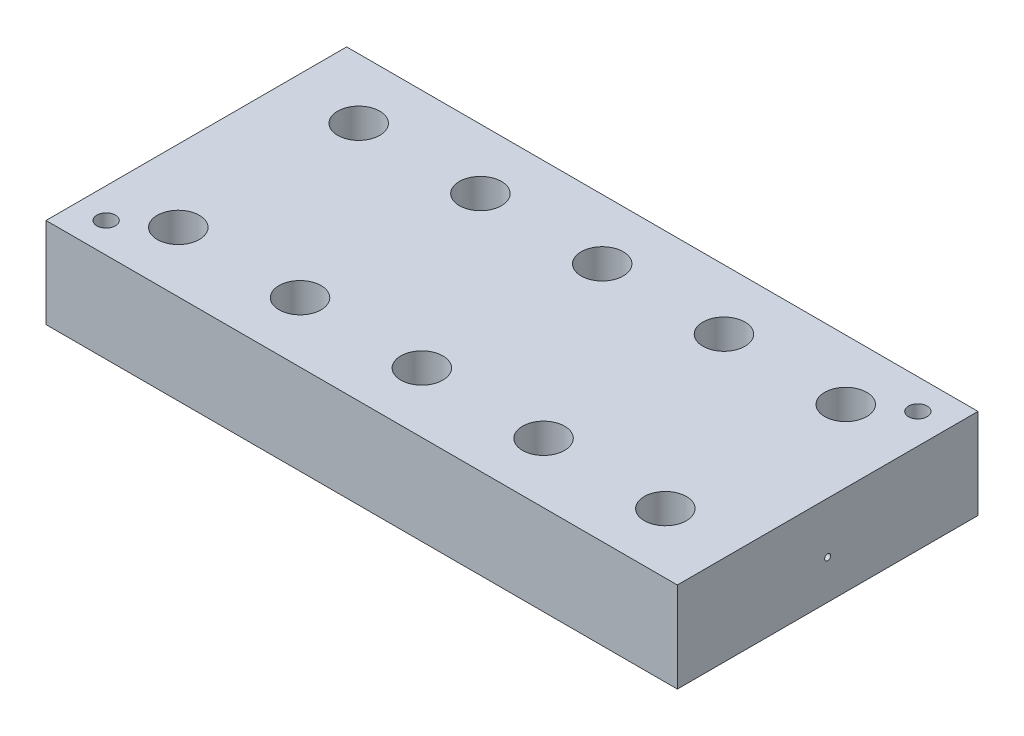
from build123d import *

# Parameters (mm, degrees)
SKETCH2_W                                            = 105
SKETCH2_H                                            = 50
BOSS_EXTRUDE1_DEPTH                                  = 15
SKIZZE7_R                                            = 2.1
SCHNITT_LINEAR_AUSTRAGEN6_DEPTH                      = 10
SKIZZE10_W                                           = 12.5
SKIZZE10_H                                           = 4
ROTATION3_ANGLE                                      = 180
SKIZZE11_W                                           = 12.5
SKIZZE11_H                                           = 4
ROTATION4_ANGLE                                      = 180
CUT_EXTRUDE2_REACH                                   = 113.55
SKETCH5_R                                            = 0.5
SKIZZE14_R                                           = 5.5
SKIZZE15_R                                           = 4
VERRUNDUNG1_R                                        = 1
AUSRICHTUNGSSTIFTE_REACH                             = 71.241
SKIZZE20_R                                           = 1.55
STIRNSENKUNG_F_R_M3_FLACHKOPFSCHRAUBE_MI_D           = 3.4
STIRNSENKUNG_F_R_M3_FLACHKOPFSCHRAUBE_MI_CBORE_D     = 7
STIRNSENKUNG_F_R_M3_FLACHKOPFSCHRAUBE_MI_CBORE_DEPTH = 9.9


with BuildPart() as part:
    # Sketch2 → Boss-Extrude1 (new body)
    with BuildSketch(Plane(origin=(0, 0, 0), x_dir=(1, 0, 0), z_dir=(0, 1, 0))):
        with Locations((5.601876656, 9.54663752)):
            Rectangle(SKETCH2_W, SKETCH2_H)
    extrude(amount=BOSS_EXTRUDE1_DEPTH)

    # Skizze7 → Schnitt-Linear austragen6 (cut)
    with BuildSketch(Plane.ZY.offset(46.898123344)):
        with Locations((-9.54663752, 7.9)):
            Circle(SKIZZE7_R)
    extrude(amount=-SCHNITT_LINEAR_AUSTRAGEN6_DEPTH, mode=Mode.SUBTRACT)

    # Sketch3 → Schnitt-Rotation1 (revolve, cut)
    with BuildSketch(Plane(origin=(0, 0, 0), x_dir=(1, 0, 0), z_dir=(0, 1, 0))):
        Polygon((48.101876656, 9.54663752), (48.101876656, 17.04663752), (-11.898123344, 17.04663752), (-11.898123344, 19.54663752), (-36.898123344, 19.54663752), (-36.898123344, 9.54663752), align=None)
    revolve(axis=Axis((74.354835368, 0, -9.54663752), (-1, 0, 0)), mode=Mode.SUBTRACT)

    # Skizze10 → Rotation3 (revolve)
    with BuildSketch(Plane.XZ):
        with Locations((31.851876656, -15.04663752)):
            Rectangle(SKIZZE10_W, SKIZZE10_H)
    revolve(axis=Axis((85.744816074, 0, -9.54663752), (1, 0, 0)), revolution_arc=ROTATION3_ANGLE)

    # Skizze11 → Rotation4 (revolve)
    with BuildSketch(Plane.XZ):
        with Locations((6.851876656, -15.04663752)):
            Rectangle(SKIZZE11_W, SKIZZE11_H)
    revolve(axis=Axis((95.037830494, 0, -9.54663752), (1, 0, 0)), revolution_arc=ROTATION4_ANGLE)

    # Sketch5 → Cut-Extrude2 (cut, up to next)
    with BuildSketch(Plane(origin=(58.101876656, 0, 0), x_dir=(0, 0, -1), z_dir=(1, 0, 0)), mode=Mode.PRIVATE) as cut_extrude2_sk1:
        with Locations((9.54663752, 6.5)):
            Circle(SKETCH5_R)
    cut_extrude2_tool1 = extrude(cut_extrude2_sk1.sketch, amount=-CUT_EXTRUDE2_REACH, mode=Mode.PRIVATE) & part.part
    add(cut_extrude2_tool1.solids().sort_by_distance((58.101877, 6.5, -9.546638))[0], mode=Mode.SUBTRACT)

    # Skizze14 → Schnitt-Ausformung1 section 0
    with BuildSketch(Plane(origin=(-36.898123344, 0, 0), x_dir=(0, 0, -1), z_dir=(1, 0, 0))):
        with Locations((9.54663752, 0)):
            Circle(SKIZZE14_R)
    # Skizze15 → Schnitt-Ausformung1 section 1
    with BuildSketch(Plane.ZY.offset(-48.101876656)):
        with Locations((-9.54663752, 0)):
            Circle(SKIZZE15_R)
    loft(mode=Mode.SUBTRACT)

    # Verrundung1
    verrundung1_edges = [part.edges().sort_by_distance(p)[0] for p in [
        (-11.898123344, 7.5, -9.54663752),
        (-11.898123344, 10, -9.54663752),
        (25.601876656, 7.5, -9.54663752),
        (38.101876656, 7.5, -9.54663752),
        (0.601876656, 7.5, -9.54663752),
        (13.101876656, 7.5, -9.54663752),
        (0.601876656, 4.838235294, -9.54663752),
        (13.101876656, 4.617647059, -9.54663752),
        (38.101876656, 4.176470588, -9.54663752),
        (25.601876656, 4.397058824, -9.54663752),
    ]]
    fillet(verrundung1_edges, radius=VERRUNDUNG1_R)

    # Skizze20 → Ausrichtungsstifte (cut, up to next)
    with BuildSketch(Plane.XZ, mode=Mode.PRIVATE) as ausrichtungsstifte_sk1:
        with Locations(Location((53.101876656, -29.54663752, 0), (0, 0, 270))):
            Circle(SKIZZE20_R)
    ausrichtungsstifte_tool1 = extrude(ausrichtungsstifte_sk1.sketch, amount=-AUSRICHTUNGSSTIFTE_REACH, mode=Mode.PRIVATE) & part.part
    # Skizze20 → Ausrichtungsstifte (cut, up to next)
    with BuildSketch(Plane.XZ, mode=Mode.PRIVATE) as ausrichtungsstifte_sk2:
        with Locations(Location((-41.898123344, 10.45336248, 0), (0, 0, 270))):
            Circle(SKIZZE20_R)
    ausrichtungsstifte_tool2 = extrude(ausrichtungsstifte_sk2.sketch, amount=-AUSRICHTUNGSSTIFTE_REACH, mode=Mode.PRIVATE) & part.part
    add(ausrichtungsstifte_tool1.solids().sort_by_distance((53.101877, 0, -29.546638))[0], mode=Mode.SUBTRACT)
    add(ausrichtungsstifte_tool2.solids().sort_by_distance((-41.898123, 0, 10.453362))[0], mode=Mode.SUBTRACT)

    # Stirnsenkung für M3 Flachkopfschraube mit Schlitz2 (through all)
    with Locations(Plane(origin=(0, 15, 0), x_dir=(1, 0, 0), z_dir=(0, 1, 0))):
        with Locations((46.101876656, 24.54663752), (25.851876656, 24.54663752), (5.601876656, 24.54663752), (-14.648123344, 24.54663752), (-34.898123344, 24.54663752), (25.851876656, -5.45336248), (5.601876656, -5.45336248), (-14.648123344, -5.45336248), (-34.898123344, -5.45336248), (46.101876656, -5.45336248)):
            CounterBoreHole(STIRNSENKUNG_F_R_M3_FLACHKOPFSCHRAUBE_MI_D / 2, STIRNSENKUNG_F_R_M3_FLACHKOPFSCHRAUBE_MI_CBORE_D / 2, STIRNSENKUNG_F_R_M3_FLACHKOPFSCHRAUBE_MI_CBORE_DEPTH)


solid = part.part
